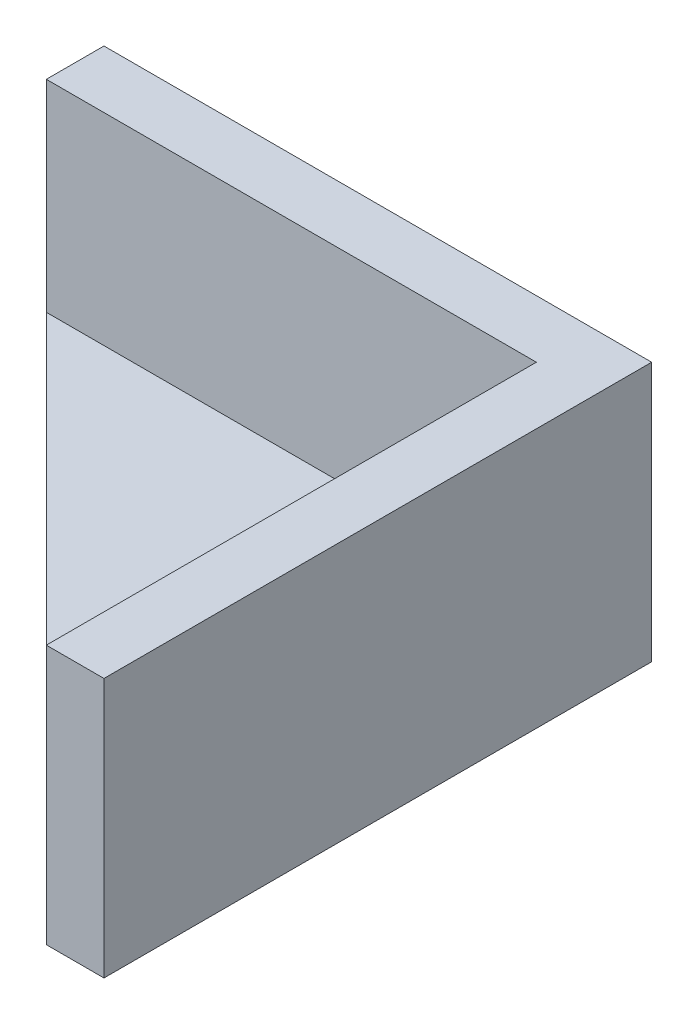
from build123d import *

# Parameters (mm, degrees)
SKETCH_1_W          = 38
SKETCH_1_H          = 18
EXTRUDE_1_DEPTH     = 4
EXTRUDE_3_DEPTH     = 34
CUT_EXTRUDE_1_DEPTH = 34


with BuildPart() as part:
    # 草图1 → 凸台-拉伸1 (new body)
    with BuildSketch(Plane.XY):
        Rectangle(SKETCH_1_W, SKETCH_1_H)
    extrude(amount=EXTRUDE_1_DEPTH)

    # 草图2 → 凸台-拉伸3 (add)
    with BuildSketch(Plane.XY.offset(4)):
        Polygon((19, 9), (19, -9), (-19, -9), (-19, -5), (15, -5), (15, 9), align=None)
    extrude(amount=EXTRUDE_3_DEPTH)

    # 草图4 → 切除-拉伸1 (cut)
    with BuildSketch(Plane(origin=(0, -5, 0), x_dir=(1, 0, 0), z_dir=(0, 1, 0))):
        Polygon((15, -38), (-19, -4), (-19, -38), align=None)
    extrude(amount=-CUT_EXTRUDE_1_DEPTH, mode=Mode.SUBTRACT)


solid = part.part
